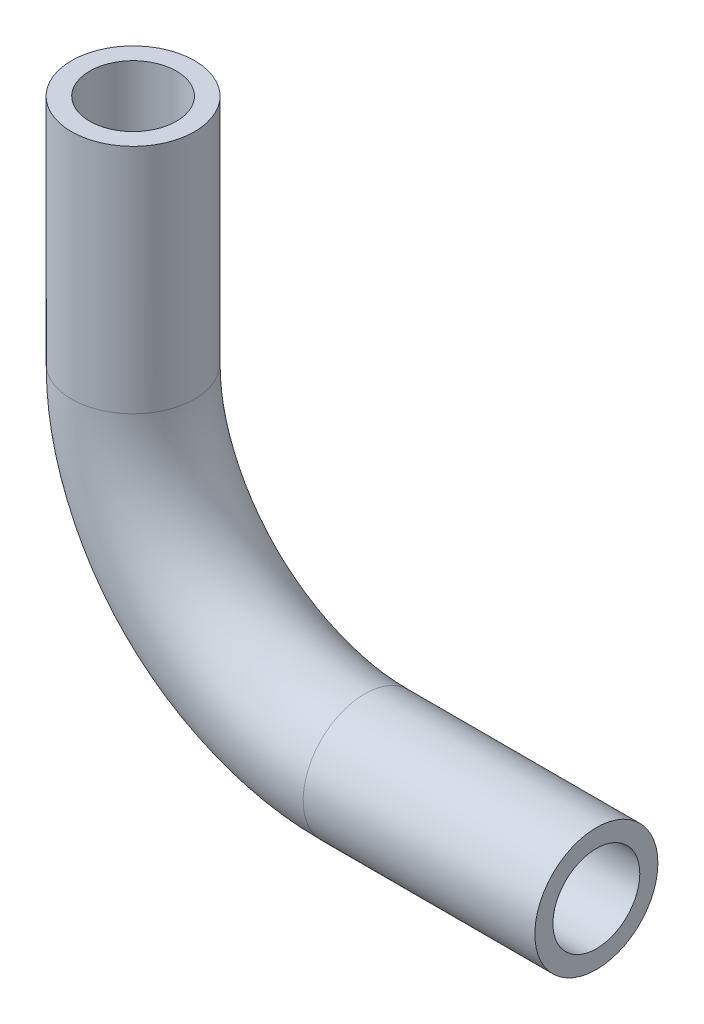
from build123d import *

# Parameters (mm, degrees)
SWEEP1_PROFILE_R     = 13.49375
CUT_SWEEP1_PROFILE_R = 9.525


with BuildPart() as part:
    # Sweep1: sweep along a path in Sketch1
    with BuildLine(Plane.XY) as sweep1_path:
        Line((-50.8, 50.8), (-50.8, 0))
        ThreePointArc((-50.8, 0), (-35.921024484, -35.921024484), (0, -50.8))
        Line((0, -50.8), (50.8, -50.8))
    # Sweep1 profile (on start of the path) → Sweep1 (sweep)
    with BuildSketch(Plane(origin=(-50.8, 50.8, 0), x_dir=(0, 0, -1), z_dir=(0, -1, 0))):
        Circle(SWEEP1_PROFILE_R)
    sweep(path=sweep1_path.line)

    # Cut-Sweep1: sweep along a path in Sketch1<4>
    with BuildLine(Plane.XY) as cut_sweep1_path:
        Line((-50.8, 50.8), (-50.8, 0))
        ThreePointArc((-50.8, 0), (-35.921024484, -35.921024484), (0, -50.8))
        Line((0, -50.8), (50.8, -50.8))
    # Cut-Sweep1 profile (on start of the path) → Cut-Sweep1 (sweep, cut)
    with BuildSketch(Plane(origin=(-50.8, 50.8, 0), x_dir=(0, 0, -1), z_dir=(0, -1, 0))):
        Circle(CUT_SWEEP1_PROFILE_R)
    sweep(path=cut_sweep1_path.line, mode=Mode.SUBTRACT)


solid = part.part
